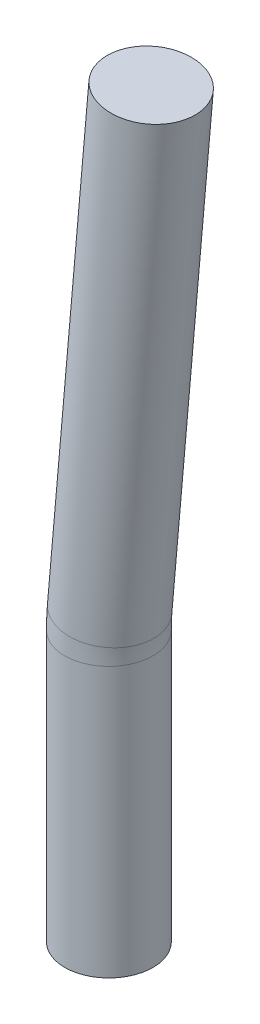
from build123d import *

# Parameters (mm, degrees)
SKETCH2_R = 3


with BuildPart() as part:
    # Sweep1: sweep along a path in Sketch1
    with BuildLine(Plane.XY) as sweep1_path:
        Line((0, 0), (0, 18.345085856))
        ThreePointArc((0, 18.345085856), (0.014276676, 18.999376667), (0.057079529, 19.652421998))
        Line((0.057079529, 19.652421998), (2.876139511, 51.874425037))
    # Sketch2 → Sweep1 (sweep)
    with BuildSketch(Plane(origin=(0, 0, 0), x_dir=(1, 0, 0), z_dir=(0, 1, 0))):
        Circle(SKETCH2_R)
    sweep(path=sweep1_path.line)


solid = part.part
